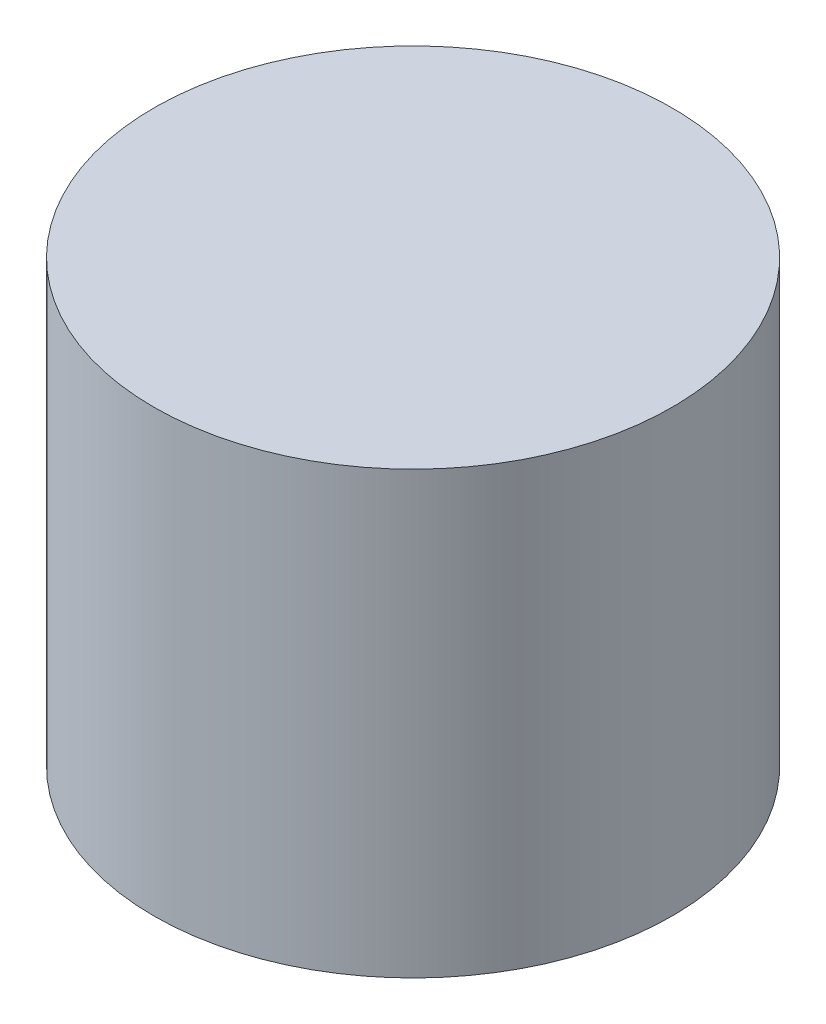
from build123d import *

# Parameters (mm, degrees)
SKETCH_1_R      = 10
EXTRUDE_1_DEPTH = 17


with BuildPart() as part:
    # Эскиз1 → Бобышка-Вытянуть1 (new body)
    with BuildSketch(Plane(origin=(0, 0, 0), x_dir=(1, 0, 0), z_dir=(0, 1, 0))):
        with Locations(Location((0, 0, 0), (0, 0, 270))):
            Circle(SKETCH_1_R)
    extrude(amount=EXTRUDE_1_DEPTH)


solid = part.part
